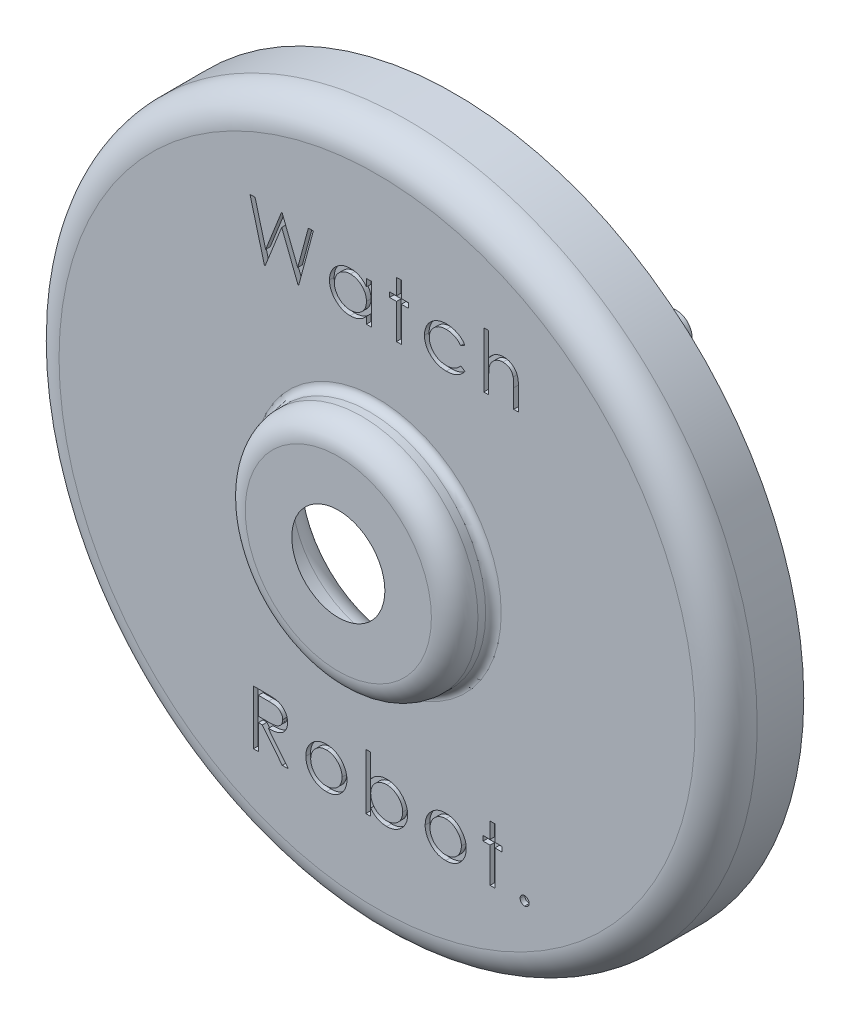
from build123d import *

# Parameters (mm, degrees)
ESQUISSE1_R             = 22.5
ESQUISSE1_R_2           = 20
BOSS_EXTRU_1_DEPTH      = 2.5
BOSS_EXTRU_2_START      = 0.5
ESQUISSE4_R             = 22.5
ESQUISSE4_R_2           = 20
BOSS_EXTRU_2_DEPTH      = 0.5
ENL_V_MAT_EXTRU_1_DEPTH = 0.3
ESQUISSE7_R             = 1
BOSS_EXTRU_3_DEPTH      = 7.3
ESQUISSE8_R             = 1.5
BOSS_EXTRU_4_DEPTH      = 1.7


with BuildPart() as part:
    # Esquisse1 → Boss.-Extru.1 (new body)
    with BuildSketch(Plane.XY):
        with Locations((0.293479975, -2.777879792)):
            Circle(ESQUISSE1_R)
        with Locations((0.293479975, -2.777879792)):
            Circle(ESQUISSE1_R_2, mode=Mode.SUBTRACT)
    extrude(amount=-BOSS_EXTRU_1_DEPTH)

    # Esquisse4 → Boss.-Extru.2 (add)
    with BuildSketch(Plane.XY.offset(BOSS_EXTRU_2_START)):
        with Locations((0.293479975, -2.777879792)):
            Circle(ESQUISSE4_R)
        with Locations((0.293479975, -2.777879792)):
            Circle(ESQUISSE4_R_2, mode=Mode.SUBTRACT)
    extrude(amount=-BOSS_EXTRU_2_DEPTH)

    # Esquisse5 → Révolution1 (revolve)
    with BuildSketch(Plane(origin=(0, -2.78, 0), x_dir=(-1, 0, 0), z_dir=(0, 1, 0))):
        with BuildLine():
            Line((-3.293479975, 5), (-6.293479975, 5))
            ThreePointArc((-6.293479975, 5), (-7.354140147, 4.560660172), (-7.793479975, 3.5))
            Line((-7.793479975, 3.5), (-7.793479975, 3))
            ThreePointArc((-7.793479975, 3), (-7.939926584, 2.646446609), (-8.293479975, 2.5))
            Line((-8.293479975, 2.5), (-20.793479975, 2.5))
            ThreePointArc((-20.793479975, 2.5), (-22.207693537, 1.914213562), (-22.793479975, 0.5))
            Line((-22.793479975, 0.5), (-20.293479975, 0.5))
            ThreePointArc((-20.293479975, 0.5), (-20.147033365, 0.853553391), (-19.793479975, 1))
            Line((-19.793479975, 1), (-7.293479975, 1))
            ThreePointArc((-7.293479975, 1), (-6.232819803, 1.439339828), (-5.793479975, 2.5))
            Line((-5.793479975, 2.5), (-5.793479975, 3.5))
            Line((-5.793479975, 3.5), (-3.293479975, 5))
        make_face()
    revolve(axis=Axis((0.293479975, -2.78, 19.488537607), (0, 0, -1)))

    # Esquisse6 → Enlèv. mat.-Extru.1 (cut)
    # profile 1 of 11: a face of its own
    with BuildSketch(Plane.XY.offset(2.5)):
        Polygon((-7.898717949, 12.5), (-7.574098558, 12.5), (-6.889102564, 9.933193109), (-5.870372596, 12.5), (-5.824799679, 12.5), (-4.825, 9.950721154), (-4.136498397, 12.5), (-3.815384615, 12.5), (-4.759094551, 9), (-4.803966346, 9), (-5.857051282, 11.676883013), (-6.92275641, 9), (-6.967628205, 9), align=None)
    # profile 2 of 11: a face of its own
    with BuildSketch(Plane.XY.offset(2.5)):
        with BuildLine():
            Line((-0.082051282, 11.557692308), (-0.082051282, 9))
            Line((-0.082051282, 9), (-0.396153846, 9))
            Line((-0.396153846, 9), (-0.396153846, 9.442407853))
            add(Edge.make_bspline(
                [(-0.396153846, 9.442407853), (-0.431572637, 9.402368259), (-0.500692852, 9.324230488), (-0.61613397, 9.222148315), (-0.738502148, 9.137769993), (-0.867203469, 9.069620078), (-1.002121712, 9.018428021), (-1.1429578, 8.982041862), (-1.289769181, 8.958648027), (-1.390021535, 8.956312005), (-1.440825321, 8.955128205)],
                knots=[0, 0, 0, 0, 1.074387032, 2.096679803, 3.090159297, 4.057316773, 5.018401886, 5.985159533, 6.978961417, 8, 8, 8, 8], degree=3))
            add(Edge.make_bspline(
                [(-1.440825321, 8.955128205), (-1.485993274, 8.956354577), (-1.575066479, 8.958773038), (-1.706095556, 8.977535341), (-1.832187806, 9.007665963), (-1.953462378, 9.049566853), (-2.069134524, 9.105147674), (-2.180194621, 9.171688922), (-2.286067313, 9.250929752), (-2.385138852, 9.341517781), (-2.476370852, 9.439912768), (-2.556432125, 9.544858315), (-2.623185204, 9.655900619), (-2.679005285, 9.771633773), (-2.72200163, 9.892948692), (-2.751975264, 10.01942586), (-2.770715711, 10.150915734), (-2.773133171, 10.240455257), (-2.774358974, 10.285857372)],
                knots=[0, 0, 0, 0, 1.033919861, 2.038935746, 3.024066025, 3.998881131, 4.97069526, 5.957263378, 6.95902576, 7.993208707, 9.027059324, 10.027763471, 11.009749337, 11.988697705, 12.965288445, 13.950418724, 14.960734635, 16, 16, 16, 16], degree=3))
            add(Edge.make_bspline(
                [(-2.774358974, 10.285857372), (-2.773106003, 10.330321075), (-2.770628946, 10.418223419), (-2.752175726, 10.547502117), (-2.721144718, 10.672020377), (-2.67759687, 10.791377321), (-2.621754915, 10.905717371), (-2.553826828, 11.015121396), (-2.473807703, 11.119890793), (-2.381555296, 11.21756202), (-2.281620526, 11.307782634), (-2.174711795, 11.38619168), (-2.063488514, 11.453908529), (-1.946225503, 11.507562005), (-1.824658399, 11.550971109), (-1.697704953, 11.581004078), (-1.565893374, 11.598701399), (-1.476402882, 11.601264163), (-1.431009615, 11.602564103)],
                knots=[0, 0, 0, 0, 1.020392517, 2.01726096, 2.990465484, 3.961182959, 4.928053699, 5.906110375, 6.912531644, 7.948652711, 8.985773172, 9.998621852, 10.987621588, 11.969261332, 12.953316658, 13.946091881, 14.958173133, 16, 16, 16, 16], degree=3))
            add(Edge.make_bspline(
                [(-1.431009615, 11.602564103), (-1.378809756, 11.601126351), (-1.276448296, 11.598306988), (-1.126720287, 11.574844261), (-0.985075809, 11.535205794), (-0.850421457, 11.481288296), (-0.723240771, 11.409639567), (-0.604737787, 11.319259606), (-0.493672303, 11.210718419), (-0.429292012, 11.127347974), (-0.396153846, 11.084435096)],
                knots=[0, 0, 0, 0, 1.038897134, 2.037228247, 3.008116434, 3.962042015, 4.918381754, 5.904844433, 6.921570401, 8, 8, 8, 8], degree=3))
            Line((-0.396153846, 11.084435096), (-0.396153846, 11.557692308))
            Line((-0.396153846, 11.557692308), (-0.082051282, 11.557692308))
        make_face()
        with BuildLine():
            add(Edge.make_bspline(
                [(-1.426802885, 11.288461538), (-1.472717222, 11.286827901), (-1.563344822, 11.28360336), (-1.696388825, 11.258429865), (-1.823702239, 11.21654527), (-1.944648313, 11.159263369), (-2.057316529, 11.087234632), (-2.1580102, 11.000113249), (-2.247552902, 10.900276235), (-2.322861166, 10.788174125), (-2.384251663, 10.667996033), (-2.427418695, 10.542371595), (-2.455887942, 10.413566618), (-2.458796463, 10.326203932), (-2.46025641, 10.282351763)],
                knots=[0, 0, 0, 0, 1.031046209, 2.035121221, 3.029706178, 4.034933723, 5.034054252, 6.02443088, 7.017295772, 8.038157696, 9.050218397, 10.03989886, 11.016116709, 12, 12, 12, 12], degree=3))
            add(Edge.make_bspline(
                [(-2.46025641, 10.282351763), (-2.458391517, 10.238761656), (-2.45466904, 10.1517523), (-2.427918346, 10.022771723), (-2.383038472, 9.897117681), (-2.32179641, 9.775856687), (-2.245109785, 9.663272587), (-2.156221132, 9.561532464), (-2.054270851, 9.474042876), (-1.941343344, 9.400805303), (-1.820735373, 9.341642782), (-1.693901442, 9.300477142), (-1.563225804, 9.273899362), (-1.47437347, 9.270794885), (-1.429607372, 9.269230769)],
                knots=[0, 0, 0, 0, 0.979072187, 1.954306742, 2.945804271, 3.96968567, 4.997920485, 5.998718438, 6.996577872, 8.005894225, 9.015743152, 10.005417472, 10.995077863, 12, 12, 12, 12], degree=3))
            add(Edge.make_bspline(
                [(-1.429607372, 9.269230769), (-1.384160869, 9.270890733), (-1.293772283, 9.274192237), (-1.160333575, 9.299473502), (-1.030838612, 9.3412423), (-0.907051383, 9.399141427), (-0.791735252, 9.470898783), (-0.688237375, 9.554905874), (-0.600721406, 9.652609058), (-0.526528797, 9.759985511), (-0.46835338, 9.877697508), (-0.425977321, 10.003031698), (-0.400923415, 10.135992447), (-0.397765685, 10.226856374), (-0.396153846, 10.273237179)],
                knots=[0, 0, 0, 0, 1.01762866, 2.023962475, 3.030623092, 4.058876274, 5.077231937, 6.066672613, 7.034107872, 8.005628644, 8.981990164, 9.965428785, 10.961468474, 12, 12, 12, 12], degree=3))
            add(Edge.make_bspline(
                [(-0.396153846, 10.273237179), (-0.397113503, 10.30857501), (-0.39900241, 10.378131043), (-0.413432979, 10.480258561), (-0.436387906, 10.577992287), (-0.468734076, 10.671434976), (-0.51122536, 10.760069991), (-0.562473126, 10.844533752), (-0.623378576, 10.924386963), (-0.692961272, 10.998530034), (-0.769126475, 11.066156496), (-0.849721015, 11.126520737), (-0.935699762, 11.17610951), (-1.025616799, 11.217150781), (-1.119628134, 11.249809931), (-1.218498753, 11.271597625), (-1.32117774, 11.286557946), (-1.391223796, 11.287820327), (-1.426802885, 11.288461538)],
                knots=[0, 0, 0, 0, 1.050140795, 2.067009409, 3.05949893, 4.030605086, 5.00011959, 5.97591094, 6.962425594, 7.979863591, 8.993523472, 9.986985069, 10.967611495, 11.937549037, 12.921786183, 13.919465291, 14.943216303, 16, 16, 16, 16], degree=3))
        make_face(mode=Mode.SUBTRACT)
    # profile 3 of 11: a face of its own
    with BuildSketch(Plane.XY.offset(2.5)):
        Polygon((1.542307692, 12.58974359), (1.856410256, 12.58974359), (1.856410256, 11.557692308), (2.305128205, 11.557692308), (2.305128205, 11.243589744), (1.856410256, 11.243589744), (1.856410256, 9), (1.542307692, 9), (1.542307692, 11.243589744), (1.093589744, 11.243589744), (1.093589744, 11.557692308), (1.542307692, 11.557692308), align=None)
    # profile 4 of 11: a face of its own
    with BuildSketch(Plane.XY.offset(2.5)):
        with BuildLine():
            Line((5.948717949, 11.003104968), (5.685797276, 10.83974359))
            add(Edge.make_bspline(
                [(5.685797276, 10.83974359), (5.65696741, 10.875571984), (5.600220715, 10.946094094), (5.501681479, 11.037104027), (5.396670064, 11.115271069), (5.283392017, 11.17897482), (5.162006217, 11.22819627), (5.032991365, 11.263026476), (4.896365861, 11.284730719), (4.802700661, 11.287197555), (4.754707532, 11.288461538)],
                knots=[0, 0, 0, 0, 1.026593902, 2.0206758, 2.988051866, 3.946915611, 4.916868779, 5.907761954, 6.927957743, 8, 8, 8, 8], degree=3))
            add(Edge.make_bspline(
                [(4.754707532, 11.288461538), (4.716348575, 11.287404696), (4.640801653, 11.285323274), (4.529895499, 11.272312781), (4.424253146, 11.248670773), (4.323212437, 11.217519816), (4.227492018, 11.175769526), (4.1368411, 11.12495977), (4.05045561, 11.06590973), (3.970838869, 10.997499184), (3.898009862, 10.923100516), (3.834910948, 10.843346821), (3.779974014, 10.76062693), (3.736868058, 10.672875188), (3.701592888, 10.582099134), (3.678386167, 10.486585279), (3.662921472, 10.387557271), (3.661152143, 10.320038931), (3.66025641, 10.285857372)],
                knots=[0, 0, 0, 0, 1.112346261, 2.190735716, 3.231507886, 4.247384806, 5.251966152, 6.253067467, 7.256802811, 8.280671706, 9.291813951, 10.270744147, 11.225547591, 12.165006084, 13.100104208, 14.043489273, 15.009504848, 16, 16, 16, 16], degree=3))
            add(Edge.make_bspline(
                [(3.66025641, 10.285857372), (3.662035662, 10.241088161), (3.665570193, 10.152152965), (3.693271653, 10.020874863), (3.73861606, 9.893951173), (3.800673911, 9.772283036), (3.879151045, 9.65968888), (3.971323608, 9.558705426), (4.077242692, 9.471289398), (4.195975022, 9.398816873), (4.324732766, 9.340555505), (4.462122871, 9.299048172), (4.607022651, 9.2739958), (4.706229398, 9.270839857), (4.756810897, 9.269230769)],
                knots=[0, 0, 0, 0, 0.966302908, 1.919585723, 2.883856336, 3.870342332, 4.860282998, 5.839159637, 6.814385684, 7.815993281, 8.834850808, 9.858348828, 10.908058873, 12, 12, 12, 12], degree=3))
            add(Edge.make_bspline(
                [(4.756810897, 9.269230769), (4.803166082, 9.270530266), (4.89426632, 9.273084123), (5.027433605, 9.294613087), (5.154213516, 9.32985672), (5.274601547, 9.37900437), (5.388377713, 9.442531886), (5.494806888, 9.520891057), (5.596006826, 9.611827657), (5.655503803, 9.682145629), (5.685797276, 9.717948718)],
                knots=[0, 0, 0, 0, 1.039848629, 2.043578496, 3.018386758, 3.987534228, 4.954977003, 5.934852016, 6.948509513, 8, 8, 8, 8], degree=3))
            Line((5.685797276, 9.717948718), (5.948717949, 9.545472756))
            add(Edge.make_bspline(
                [(5.948717949, 9.545472756), (5.933130247, 9.522582029), (5.90200658, 9.476876553), (5.849978954, 9.412432436), (5.793859122, 9.352110754), (5.733866026, 9.295992364), (5.670783016, 9.242734345), (5.602455106, 9.19488277), (5.531085495, 9.149747947), (5.455836337, 9.109135075), (5.377485639, 9.072628754), (5.296143649, 9.041237583), (5.212163837, 9.014267477), (5.12544746, 8.99283013), (5.035823562, 8.975719292), (4.943523928, 8.96436559), (4.848580346, 8.955890309), (4.784408195, 8.955384442), (4.751903045, 8.955128205)],
                knots=[0, 0, 0, 0, 0.954134338, 1.905101784, 2.851144739, 3.791306361, 4.734911809, 5.6936923, 6.663572882, 7.643865596, 8.638447847, 9.640600242, 10.646758161, 11.676244097, 12.717260333, 13.78922464, 14.880174919, 16, 16, 16, 16], degree=3))
            add(Edge.make_bspline(
                [(4.751903045, 8.955128205), (4.702292161, 8.956019485), (4.605054469, 8.9577664), (4.462731961, 8.976974875), (4.326718294, 9.005932491), (4.197059936, 9.047496225), (4.073736702, 9.101001001), (3.956863584, 9.166357915), (3.846827566, 9.244109705), (3.744716783, 9.332872475), (3.650935337, 9.429113115), (3.570409146, 9.532963033), (3.500563876, 9.640604081), (3.444476333, 9.754413607), (3.399829406, 9.87287898), (3.369324574, 9.99694922), (3.349594836, 10.125601474), (3.347311456, 10.213334356), (3.346153846, 10.2578125)],
                knots=[0, 0, 0, 0, 1.1129367, 2.181364009, 3.217532258, 4.231199276, 5.232079859, 6.230262199, 7.231623845, 8.250719726, 9.263571943, 10.242672461, 11.195837495, 12.138959767, 13.085126421, 14.0317438, 15.002148558, 16, 16, 16, 16], degree=3))
            add(Edge.make_bspline(
                [(3.346153846, 10.2578125), (3.346594862, 10.287990935), (3.347472116, 10.348020822), (3.357534044, 10.437115889), (3.370532517, 10.525024434), (3.392558254, 10.610632153), (3.417998886, 10.695237443), (3.450474417, 10.777820545), (3.488569812, 10.858765217), (3.53182176, 10.937862947), (3.580510505, 11.013812487), (3.634391738, 11.085566151), (3.691436074, 11.153985917), (3.754312186, 11.216709677), (3.82035184, 11.276245869), (3.891423416, 11.331003993), (3.967119267, 11.381144984), (4.04630259, 11.427595999), (4.128927301, 11.468955434), (4.214493972, 11.504588672), (4.302487001, 11.535041248), (4.393047145, 11.559150167), (4.485573318, 11.579367591), (4.580794656, 11.592085437), (4.678346878, 11.60107171), (4.744402901, 11.602062502), (4.777844551, 11.602564103)],
                knots=[0, 0, 0, 0, 0.990994727, 1.971252077, 2.943264845, 3.907940874, 4.872158414, 5.844625996, 6.82015047, 7.809835459, 8.804511986, 9.781214284, 10.756496977, 11.728388426, 12.696359165, 13.676225489, 14.672885716, 15.677705647, 16.690706858, 17.706033469, 18.721040654, 19.747369689, 20.783475414, 21.830280724, 22.901553713, 24, 24, 24, 24], degree=3))
            add(Edge.make_bspline(
                [(4.777844551, 11.602564103), (4.819724659, 11.601642212), (4.903275539, 11.599803037), (5.027216246, 11.584324385), (5.14933144, 11.560987969), (5.267478543, 11.526415139), (5.380225057, 11.484551483), (5.485760508, 11.437538769), (5.581600611, 11.382944165), (5.669528201, 11.323224051), (5.749707718, 11.255863145), (5.822962211, 11.180056188), (5.89079386, 11.096197709), (5.929250571, 11.034391978), (5.948717949, 11.003104968)],
                knots=[0, 0, 0, 0, 1.095225653, 2.184976855, 3.262915854, 4.344593502, 5.400796181, 6.407717688, 7.363229445, 8.282371371, 9.184954523, 10.097238608, 11.036792983, 12, 12, 12, 12], degree=3))
        make_face()
    # profile 5 of 11: a face of its own
    with BuildSketch(Plane.XY.offset(2.5)):
        with BuildLine():
            Line((7.169230769, 12.58974359), (7.483333333, 12.58974359))
            Line((7.483333333, 12.58974359), (7.483333333, 11.074619391))
            add(Edge.make_bspline(
                [(7.483333333, 11.074619391), (7.517050635, 11.116763373), (7.582699949, 11.198819866), (7.693196066, 11.305881057), (7.806666938, 11.398679678), (7.927031748, 11.472550135), (8.052082268, 11.530906678), (8.182345912, 11.572294325), (8.317846884, 11.597745421), (8.409872034, 11.600943839), (8.456490385, 11.602564103)],
                knots=[0, 0, 0, 0, 1.125788106, 2.19196713, 3.20547328, 4.180437432, 5.132270164, 6.079753143, 7.027236121, 8, 8, 8, 8], degree=3))
            add(Edge.make_bspline(
                [(8.456490385, 11.602564103), (8.503820777, 11.600818672), (8.596457773, 11.597402444), (8.731339236, 11.570389063), (8.857300111, 11.524231625), (8.973965953, 11.4610646), (9.07879065, 11.382391773), (9.171640415, 11.29156025), (9.247481213, 11.186286332), (9.29908033, 11.089030078), (9.332653738, 11.002491324), (9.353905565, 10.928254812), (9.371924763, 10.845532899), (9.387624499, 10.754368166), (9.39808808, 10.654322995), (9.406492698, 10.545848741), (9.412469153, 10.428951622), (9.412700757, 10.348031373), (9.412820513, 10.306189904)],
                knots=[0, 0, 0, 0, 1.235656852, 2.418478516, 3.575258207, 4.727955599, 5.870717718, 6.98870536, 8.107142894, 9.245821548, 9.854588956, 10.528768408, 11.260415777, 12.065282286, 12.943670737, 13.886611085, 14.907229059, 16, 16, 16, 16], degree=3))
            Line((9.412820513, 10.306189904), (9.412820513, 9))
            Line((9.412820513, 9), (9.098717949, 9))
            Line((9.098717949, 9), (9.098717949, 10.203125))
            add(Edge.make_bspline(
                [(9.098717949, 10.203125), (9.098527646, 10.23794767), (9.098163628, 10.30455751), (9.096960283, 10.399923618), (9.094274068, 10.486419753), (9.089933242, 10.563768705), (9.085367935, 10.632078308), (9.079084618, 10.691249362), (9.071774384, 10.741363138), (9.065205602, 10.771527766), (9.062259615, 10.78505609)],
                knots=[0, 0, 0, 0, 1.430932559, 2.737130458, 3.918967929, 4.986496826, 5.920444988, 6.731744033, 7.431208747, 8, 8, 8, 8], degree=3))
            add(Edge.make_bspline(
                [(9.062259615, 10.78505609), (9.05083537, 10.824750353), (9.028872326, 10.901062344), (8.977824348, 11.004724754), (8.914065337, 11.093109495), (8.836218076, 11.165023783), (8.745659712, 11.221435322), (8.641799748, 11.260503105), (8.525615679, 11.284750827), (8.443764207, 11.28719013), (8.401101763, 11.288461538)],
                knots=[0, 0, 0, 0, 1.090059168, 2.095632401, 3.037101401, 3.955032261, 4.878929692, 5.839099886, 6.873700383, 8, 8, 8, 8], degree=3))
            add(Edge.make_bspline(
                [(8.401101763, 11.288461538), (8.37583399, 11.287985712), (8.325829719, 11.287044064), (8.251681054, 11.277590166), (8.17975199, 11.262141447), (8.109349812, 11.241236908), (8.041966614, 11.212791372), (7.97563829, 11.179861183), (7.912244081, 11.139552928), (7.850658264, 11.09432716), (7.79334073, 11.0442574), (7.740013615, 10.991410445), (7.692475275, 10.935135481), (7.649406684, 10.876335365), (7.612228398, 10.814203572), (7.579775316, 10.749339253), (7.55223962, 10.681657108), (7.538556927, 10.634682046), (7.531710737, 10.611177885)],
                knots=[0, 0, 0, 0, 1.024319606, 2.027102035, 3.025350316, 4.005802111, 5.00026367, 5.987881639, 7.005602596, 8.042517216, 9.083927026, 10.089214625, 11.084353441, 12.06828073, 13.041928858, 14.016821737, 15.00770877, 16, 16, 16, 16], degree=3))
            add(Edge.make_bspline(
                [(7.531710737, 10.611177885), (7.52777131, 10.594156934), (7.519186813, 10.557066187), (7.50987198, 10.495891863), (7.501534183, 10.424805491), (7.494485633, 10.34391489), (7.490162547, 10.252923648), (7.485504306, 10.152452689), (7.483770292, 10.041872668), (7.483483339, 9.964977161), (7.483333333, 9.924779647)],
                knots=[0, 0, 0, 0, 0.607992626, 1.324890765, 2.152360218, 3.099583803, 4.150613268, 5.323148443, 6.60066238, 8, 8, 8, 8], degree=3))
            Line((7.483333333, 9.924779647), (7.483333333, 9))
            Line((7.483333333, 9), (7.169230769, 9))
            Line((7.169230769, 9), (7.169230769, 12.58974359))
        make_face()
    # profile 6 of 11: a face of its own
    with BuildSketch(Plane.XY.offset(2.5)):
        with BuildLine():
            Line((-7.674358974, -14.833333333), (-6.973938301, -14.833333333))
            add(Edge.make_bspline(
                [(-6.973938301, -14.833333333), (-6.927197173, -14.833488919), (-6.837449028, -14.833787662), (-6.708875758, -14.835453425), (-6.592048661, -14.84022778), (-6.487028822, -14.844336364), (-6.393818167, -14.851828305), (-6.312130876, -14.858988952), (-6.242343178, -14.868362613), (-6.200097327, -14.877068036), (-6.180969551, -14.881009615)],
                knots=[0, 0, 0, 0, 1.410062039, 2.707475311, 3.878576406, 4.937260626, 5.877586885, 6.699081471, 7.410979367, 8, 8, 8, 8], degree=3))
            add(Edge.make_bspline(
                [(-6.180969551, -14.881009615), (-6.155362927, -14.887336381), (-6.104695938, -14.899854944), (-6.031745872, -14.926314545), (-5.962231548, -14.95693417), (-5.896441723, -14.99289789), (-5.834705932, -15.03447267), (-5.776387621, -15.080940792), (-5.721222158, -15.132047998), (-5.671440528, -15.18908284), (-5.624501476, -15.248919349), (-5.58491285, -15.313623106), (-5.55078637, -15.381284634), (-5.523615853, -15.452592051), (-5.501737879, -15.526853823), (-5.48631164, -15.60474262), (-5.477060452, -15.685903595), (-5.476118597, -15.741261504), (-5.475641026, -15.769330929)],
                knots=[0, 0, 0, 0, 1.027469482, 2.033020251, 3.019912614, 3.986113645, 4.951240523, 5.91722682, 6.890402269, 7.87763091, 8.8651537, 9.85103654, 10.82876324, 11.815024772, 12.821070561, 13.842952187, 14.906261191, 16, 16, 16, 16], degree=3))
            add(Edge.make_bspline(
                [(-5.475641026, -15.769330929), (-5.477110024, -15.815966034), (-5.47997642, -15.906963202), (-5.506701523, -16.039024083), (-5.550478043, -16.162213398), (-5.610801332, -16.276376036), (-5.687620808, -16.379286681), (-5.779945599, -16.469677137), (-5.88782721, -16.545317049), (-5.988256526, -16.597769854), (-6.076970726, -16.631362763), (-6.150004039, -16.654999121), (-6.229671016, -16.673261087), (-6.315208351, -16.689621218), (-6.406972006, -16.701972913), (-6.504742046, -16.711019507), (-6.608588197, -16.716673556), (-6.679927267, -16.717515561), (-6.716626603, -16.717948718)],
                knots=[0, 0, 0, 0, 1.260483769, 2.459530307, 3.627416485, 4.787058657, 5.939039949, 7.08810263, 8.267026773, 9.491475466, 10.141966685, 10.831826277, 11.566392101, 12.351337768, 13.187381173, 14.07005841, 15.007169909, 16, 16, 16, 16], degree=3))
            Line((-6.716626603, -16.717948718), (-5.430769231, -18.333333333))
            Line((-5.430769231, -18.333333333), (-5.819190705, -18.333333333))
            Line((-5.819190705, -18.333333333), (-7.105048077, -16.717948718))
            Line((-7.105048077, -16.717948718), (-7.36025641, -16.717948718))
            Line((-7.36025641, -16.717948718), (-7.36025641, -18.333333333))
            Line((-7.36025641, -18.333333333), (-7.674358974, -18.333333333))
            Line((-7.674358974, -18.333333333), (-7.674358974, -14.833333333))
        make_face()
        with BuildLine():
            Line((-7.36025641, -15.192307692), (-7.36025641, -16.358974359))
            Line((-7.36025641, -16.358974359), (-6.71943109, -16.363882212))
            add(Edge.make_bspline(
                [(-6.71943109, -16.363882212), (-6.689511051, -16.363895448), (-6.631517494, -16.363921105), (-6.547616829, -16.359927328), (-6.469496717, -16.35538401), (-6.397455965, -16.348434665), (-6.33146239, -16.339478593), (-6.271548976, -16.328275609), (-6.217617925, -16.315223546), (-6.154719386, -16.29502192), (-6.084482855, -16.263015902), (-6.008151395, -16.216450403), (-5.943149057, -16.157881284), (-5.888231195, -16.090907828), (-5.844101763, -16.017271579), (-5.812989709, -15.93785521), (-5.793247267, -15.854663612), (-5.790918721, -15.797485504), (-5.78974359, -15.768629808)],
                knots=[0, 0, 0, 0, 1.146690395, 2.22261258, 3.21895312, 4.145990853, 4.996080663, 5.770904154, 6.481378293, 7.121626537, 8.300444488, 9.431385265, 10.535395872, 11.636531494, 12.74115979, 13.810798291, 14.895190096, 16, 16, 16, 16], degree=3))
            add(Edge.make_bspline(
                [(-5.78974359, -15.768629808), (-5.790945711, -15.740483234), (-5.793327876, -15.684706995), (-5.812776645, -15.603051085), (-5.845666026, -15.525984135), (-5.889988264, -15.45381965), (-5.943987419, -15.388313914), (-6.007305232, -15.332266761), (-6.078210427, -15.286017296), (-6.144481625, -15.256462916), (-6.203715838, -15.238343063), (-6.255145498, -15.225591899), (-6.313256975, -15.21534743), (-6.378332434, -15.207139369), (-6.450094065, -15.200084425), (-6.528904716, -15.195332646), (-6.614241496, -15.192518782), (-6.673388427, -15.192379693), (-6.70400641, -15.192307692)],
                knots=[0, 0, 0, 0, 1.101028733, 2.181837193, 3.264309656, 4.369019818, 5.486613113, 6.575447106, 7.666700264, 8.788928104, 9.402425223, 10.0903467, 10.862060571, 11.710948788, 12.657782767, 13.684531032, 14.801375019, 16, 16, 16, 16], degree=3))
            Line((-6.70400641, -15.192307692), (-7.36025641, -15.192307692))
        make_face(mode=Mode.SUBTRACT)
    # profile 7 of 11: a face of its own
    with BuildSketch(Plane.XY.offset(2.5)):
        with BuildLine():
            add(Edge.make_bspline(
                [(-2.974879808, -15.730769231), (-2.926888535, -15.731791122), (-2.832789377, -15.733794801), (-2.694981491, -15.755209766), (-2.563436355, -15.787957131), (-2.437650163, -15.833228693), (-2.319233868, -15.893910643), (-2.206462624, -15.966319934), (-2.099645615, -16.052102528), (-2.035622586, -16.118460596), (-2.003125, -16.152143429)],
                knots=[0, 0, 0, 0, 1.054011418, 2.066658804, 3.057071809, 4.030435133, 4.997543892, 5.974964718, 6.972108034, 8, 8, 8, 8], degree=3))
            add(Edge.make_bspline(
                [(-2.003125, -16.152143429), (-1.975143046, -16.184357415), (-1.919720666, -16.248161957), (-1.848654947, -16.35161757), (-1.787433387, -16.458757671), (-1.738370426, -16.571004998), (-1.699685402, -16.687379669), (-1.672219706, -16.80828168), (-1.655882771, -16.933444027), (-1.653679804, -17.018447865), (-1.652564103, -17.061498397)],
                knots=[0, 0, 0, 0, 1.025258237, 2.030674902, 3.01204498, 3.988269485, 4.97094183, 5.956517959, 6.965070386, 8, 8, 8, 8], degree=3))
            add(Edge.make_bspline(
                [(-1.652564103, -17.061498397), (-1.65354544, -17.104798455), (-1.655484608, -17.190361388), (-1.673828225, -17.316380754), (-1.70235931, -17.438575577), (-1.743191149, -17.556434271), (-1.795549258, -17.670317098), (-1.859439945, -17.779726647), (-1.935311563, -17.884878781), (-2.021315559, -17.984880619), (-2.116367435, -18.077046834), (-2.219483584, -18.157375103), (-2.328637618, -18.226196628), (-2.445280971, -18.281633043), (-2.568348458, -18.325342744), (-2.698105526, -18.35604276), (-2.834350596, -18.374604444), (-2.927377817, -18.376988017), (-2.974879808, -18.378205128)],
                knots=[0, 0, 0, 0, 0.998656419, 1.973391657, 2.932242238, 3.890759089, 4.846373663, 5.82037756, 6.809684879, 7.83454468, 8.860553229, 9.859544525, 10.845671541, 11.83227036, 12.833544569, 13.85385346, 14.904124723, 16, 16, 16, 16], degree=3))
            add(Edge.make_bspline(
                [(-2.974879808, -18.378205128), (-3.022614527, -18.376983932), (-3.116105387, -18.374592158), (-3.252831369, -18.356114875), (-3.382820988, -18.325356892), (-3.506049586, -18.281489399), (-3.623194433, -18.226194856), (-3.73298093, -18.157583166), (-3.836180846, -18.077023011), (-3.93125283, -17.984887074), (-4.017251435, -17.884877118), (-4.093124444, -17.779727079), (-4.15701477, -17.670316986), (-4.209372974, -17.556434301), (-4.250204787, -17.438575569), (-4.278735879, -17.316380756), (-4.297079494, -17.190361388), (-4.299018663, -17.104798455), (-4.3, -17.061498397)],
                knots=[0, 0, 0, 0, 1.099876186, 2.154163076, 3.173186993, 4.173200201, 5.163417411, 6.152872554, 7.150605724, 8.17532212, 9.198891216, 10.186952605, 11.159729845, 12.11414092, 13.071450619, 14.029093627, 15.002601286, 16, 16, 16, 16], degree=3))
            add(Edge.make_bspline(
                [(-4.3, -17.061498397), (-4.29887669, -17.018681852), (-4.296652728, -16.933912449), (-4.280332219, -16.808985388), (-4.252973663, -16.688287999), (-4.214242266, -16.572362523), (-4.164727075, -16.460607087), (-4.104365787, -16.353202256), (-4.032575155, -16.250214456), (-3.977373203, -16.186492376), (-3.949439103, -16.154246795)],
                knots=[0, 0, 0, 0, 1.031353054, 2.041901799, 3.029428768, 4.008703097, 4.981709435, 5.96992636, 6.972712378, 8, 8, 8, 8], degree=3))
            add(Edge.make_bspline(
                [(-3.949439103, -16.154246795), (-3.916990512, -16.120271856), (-3.853174648, -16.053454159), (-3.74582592, -15.967921635), (-3.633332099, -15.894005561), (-3.513607173, -15.834529346), (-3.387924315, -15.787690828), (-3.255705072, -15.755125313), (-3.117429557, -15.733871958), (-3.022869936, -15.73181378), (-2.974879808, -15.730769231)],
                knots=[0, 0, 0, 0, 1.027980169, 2.021703884, 2.998553061, 3.971491411, 4.943284454, 5.930300938, 6.949603206, 8, 8, 8, 8], degree=3))
        make_face()
        with BuildLine():
            add(Edge.make_bspline(
                [(-2.976282051, -16.044871795), (-3.010219663, -16.045836387), (-3.077218791, -16.047740669), (-3.175838376, -16.062224574), (-3.27077853, -16.085172078), (-3.362219374, -16.117776134), (-3.449852546, -16.159875033), (-3.533761949, -16.211583393), (-3.614194389, -16.27221635), (-3.689576452, -16.341679021), (-3.758758764, -16.417558016), (-3.819236741, -16.498406375), (-3.870661847, -16.582912721), (-3.913502006, -16.671164932), (-3.945409194, -16.764057346), (-3.968582217, -16.860537977), (-3.983052457, -16.960803394), (-3.984938836, -17.028964412), (-3.985897436, -17.063601763)],
                knots=[0, 0, 0, 0, 1.021534396, 2.016698045, 2.994645724, 3.958388632, 4.93408049, 5.916473867, 6.921342795, 7.962252576, 8.998418191, 10.008913653, 10.997312074, 11.973003931, 12.956656626, 13.948281152, 14.957379055, 16, 16, 16, 16], degree=3))
            add(Edge.make_bspline(
                [(-3.985897436, -17.063601763), (-3.984290612, -17.10835379), (-3.981101368, -17.197178195), (-3.955166131, -17.327989318), (-3.911779851, -17.45357117), (-3.853192572, -17.573187556), (-3.779786353, -17.683859834), (-3.693299286, -17.782531319), (-3.594659586, -17.86771713), (-3.485043086, -17.938397976), (-3.366688768, -17.994557731), (-3.241432447, -18.034356707), (-3.110791753, -18.0602284), (-3.021511022, -18.062799874), (-2.976282051, -18.064102564)],
                knots=[0, 0, 0, 0, 1.016792936, 2.018143844, 3.017858371, 4.030088057, 5.03801393, 6.028138512, 7.003788237, 7.991172063, 8.984598303, 9.972568034, 10.972917682, 12, 12, 12, 12], degree=3))
            add(Edge.make_bspline(
                [(-2.976282051, -18.064102564), (-2.931055682, -18.062792284), (-2.841780086, -18.060205827), (-2.71132091, -18.034487007), (-2.586406938, -17.994383347), (-2.46817555, -17.938461137), (-2.358608947, -17.867448722), (-2.259259825, -17.783012345), (-2.173511214, -17.683598493), (-2.100177609, -17.573040965), (-2.040630867, -17.453756613), (-1.997447665, -17.32796614), (-1.971450079, -17.197184098), (-1.96826925, -17.108355768), (-1.966666667, -17.063601763)],
                knots=[0, 0, 0, 0, 1.02726834, 2.027799167, 3.010890988, 4.004497153, 4.992059811, 5.971914811, 6.958719428, 7.966827853, 8.981595046, 9.981490638, 10.983022906, 12, 12, 12, 12], degree=3))
            add(Edge.make_bspline(
                [(-1.966666667, -17.063601763), (-1.967624937, -17.028964205), (-1.969510666, -16.960802779), (-1.98398563, -16.860540326), (-2.00714117, -16.764048729), (-2.039112787, -16.671196726), (-2.081766801, -16.582684222), (-2.134183594, -16.498654495), (-2.194414619, -16.417277949), (-2.26443174, -16.341924308), (-2.339735118, -16.272189271), (-2.420200156, -16.211559882), (-2.503985135, -16.160102286), (-2.591363718, -16.117416046), (-2.682816285, -16.085468705), (-2.777623414, -16.062092074), (-2.875822224, -16.047801877), (-2.942581268, -16.045854736), (-2.976282051, -16.044871795)],
                knots=[0, 0, 0, 0, 1.042956736, 2.052379634, 3.044323526, 4.02829302, 5.004299113, 5.996692471, 7.007513377, 8.048758398, 9.090003419, 10.095195979, 11.07790575, 12.047570684, 13.018257071, 13.989683339, 14.985167495, 16, 16, 16, 16], degree=3))
        make_face(mode=Mode.SUBTRACT)
    # profile 8 of 11: a face of its own
    with BuildSketch(Plane.XY.offset(2.5)):
        with BuildLine():
            Line((-0.432051282, -18.333333333), (-0.432051282, -14.743589744))
            Line((-0.432051282, -14.743589744), (-0.117948718, -14.743589744))
            Line((-0.117948718, -14.743589744), (-0.117948718, -16.239783654))
            add(Edge.make_bspline(
                [(-0.117948718, -16.239783654), (-0.082555299, -16.199025722), (-0.01350128, -16.119505317), (0.102275172, -16.015657667), (0.223680741, -15.92760519), (0.351638997, -15.855019071), (0.48633193, -15.799745464), (0.627064039, -15.759323074), (0.77419508, -15.734936171), (0.874514254, -15.732170098), (0.925320513, -15.730769231)],
                knots=[0, 0, 0, 0, 1.077089805, 2.101446609, 3.097517232, 4.067117542, 5.031729543, 5.997785507, 6.985986182, 8, 8, 8, 8], degree=3))
            add(Edge.make_bspline(
                [(0.925320513, -15.730769231), (0.970486651, -15.732009459), (1.059787803, -15.734461601), (1.19106995, -15.753096097), (1.317383225, -15.783313899), (1.438658873, -15.825206078), (1.554331005, -15.880789055), (1.665390062, -15.947330363), (1.771267047, -16.026568692), (1.870321932, -16.117167003), (1.961615818, -16.215523626), (2.041528329, -16.320703941), (2.109028025, -16.431179031), (2.164859317, -16.546579094), (2.20803037, -16.667375445), (2.237772638, -16.793449644), (2.256666102, -16.924677662), (2.259046348, -17.013990466), (2.26025641, -17.059395032)],
                knots=[0, 0, 0, 0, 1.034377878, 2.045141349, 3.03070803, 4.00595497, 4.978199603, 5.965204761, 6.967410914, 8.002051993, 9.036360596, 10.037508045, 11.022711142, 11.997267194, 12.969246472, 13.954813154, 14.960274251, 16, 16, 16, 16], degree=3))
            add(Edge.make_bspline(
                [(2.26025641, -17.059395032), (2.25901997, -17.10409505), (2.256581904, -17.192236445), (2.237960596, -17.321943001), (2.207214331, -17.4467817), (2.163253148, -17.566429958), (2.107988209, -17.681449871), (2.038876933, -17.790530275), (1.959065934, -17.895569251), (1.866734785, -17.993192882), (1.766821232, -18.083426282), (1.65990699, -18.161832148), (1.548685068, -18.229549268), (1.431421956, -18.283204715), (1.309853914, -18.326605637), (1.182678527, -18.356723327), (1.050615299, -18.374296382), (0.960896411, -18.376891949), (0.915504808, -18.378205128)],
                knots=[0, 0, 0, 0, 1.024244038, 2.01964794, 2.996620209, 3.965911562, 4.936179293, 5.91563013, 6.920572822, 7.955171681, 8.990768464, 10.002129126, 10.989675881, 11.969873457, 12.952483066, 13.943799762, 14.959703725, 16, 16, 16, 16], degree=3))
            add(Edge.make_bspline(
                [(0.915504808, -18.378205128), (0.863539695, -18.37676452), (0.761645171, -18.373939738), (0.612592506, -18.350520759), (0.471510956, -18.310659149), (0.336793408, -18.257097393), (0.210365685, -18.184568739), (0.091425103, -18.094611989), (-0.01927827, -17.985744852), (-0.084495085, -17.902683363), (-0.117948718, -17.860076122)],
                knots=[0, 0, 0, 0, 1.035807596, 2.031038093, 2.998900396, 3.954262848, 4.914341711, 5.895762244, 6.92060972, 8, 8, 8, 8], degree=3))
            Line((-0.117948718, -17.860076122), (-0.117948718, -18.333333333))
            Line((-0.117948718, -18.333333333), (-0.432051282, -18.333333333))
        make_face()
        with BuildLine():
            add(Edge.make_bspline(
                [(0.912700321, -18.064102564), (0.958614673, -18.062468935), (1.049242302, -18.059244412), (1.182286092, -18.034070789), (1.309600302, -17.992186675), (1.430543384, -17.934902966), (1.543222696, -17.862880932), (1.64387533, -17.775734761), (1.73335504, -17.676233246), (1.808006816, -17.563999553), (1.87033306, -17.444548584), (1.913146336, -17.318894283), (1.941866058, -17.190399493), (1.944718356, -17.103253449), (1.946153846, -17.059395032)],
                knots=[0, 0, 0, 0, 1.031910345, 2.036826888, 3.032245421, 4.038315463, 5.03827337, 6.029480047, 7.023177075, 8.037597977, 9.052889626, 10.043399556, 11.015292101, 12, 12, 12, 12], degree=3))
            add(Edge.make_bspline(
                [(1.946153846, -17.059395032), (1.944266102, -17.01557949), (1.940498151, -16.928123329), (1.914123368, -16.798473662), (1.868065578, -16.672886037), (1.806947555, -16.551708049), (1.73107957, -16.438700248), (1.642073606, -16.337210121), (1.5401918, -16.249650137), (1.427368381, -16.176660066), (1.30718819, -16.117100513), (1.180697556, -16.076255487), (1.050539434, -16.0495173), (0.962143941, -16.046428172), (0.917608173, -16.044871795)],
                knots=[0, 0, 0, 0, 0.984795267, 1.965658976, 2.959410029, 3.983795688, 5.009594896, 6.01088574, 7.009236619, 8.019050059, 9.024672985, 10.014834719, 10.999826153, 12, 12, 12, 12], degree=3))
            add(Edge.make_bspline(
                [(0.917608173, -16.044871795), (0.872140666, -16.046427292), (0.781896889, -16.049514639), (0.648728667, -16.076302463), (0.518665383, -16.117350075), (0.394377851, -16.176281424), (0.278523796, -16.248392884), (0.174911184, -16.333133084), (0.085579626, -16.429912992), (0.012035855, -16.538418794), (-0.046368944, -16.655603829), (-0.088152692, -16.780616033), (-0.113152338, -16.912797345), (-0.116330471, -17.003430551), (-0.117948718, -17.049579327)],
                knots=[0, 0, 0, 0, 1.016820015, 2.018181405, 3.029022337, 4.06341356, 5.088169224, 6.076823655, 7.05054209, 8.02560866, 9.001194327, 9.972267242, 10.967515442, 12, 12, 12, 12], degree=3))
            add(Edge.make_bspline(
                [(-0.117948718, -17.049579327), (-0.116989048, -17.084917145), (-0.115100112, -17.154473155), (-0.100669744, -17.256600846), (-0.077714082, -17.354333938), (-0.045370588, -17.447778933), (-0.002869353, -17.536405373), (0.048340912, -17.620901453), (0.109292559, -17.700504731), (0.178199148, -17.775020052), (0.254161529, -17.842829466), (0.335684648, -17.901607691), (0.421102578, -17.952221881), (0.511392549, -17.992566724), (0.60550384, -18.025493244), (0.704402181, -18.04722699), (0.807073605, -18.062202029), (0.877120702, -18.063462382), (0.912700321, -18.064102564)],
                knots=[0, 0, 0, 0, 1.050331198, 2.067384183, 3.060053655, 4.031335885, 5.001026174, 5.976994447, 6.963687968, 7.976578778, 8.990422448, 9.985569286, 10.960374351, 11.936812464, 12.921228065, 13.919088064, 14.943024695, 16, 16, 16, 16], degree=3))
        make_face(mode=Mode.SUBTRACT)
    # profile 9 of 11: a face of its own
    with BuildSketch(Plane.XY.offset(2.5)):
        with BuildLine():
            add(Edge.make_bspline(
                [(4.716145833, -15.730769231), (4.764137106, -15.731791122), (4.858236264, -15.733794801), (4.99604415, -15.755209766), (5.127589286, -15.787957131), (5.253375478, -15.833228693), (5.371791773, -15.893910643), (5.484563017, -15.966319934), (5.591380026, -16.052102528), (5.655403055, -16.118460596), (5.687900641, -16.152143429)],
                knots=[0, 0, 0, 0, 1.054011418, 2.066658804, 3.057071809, 4.030435133, 4.997543892, 5.974964718, 6.972108034, 8, 8, 8, 8], degree=3))
            add(Edge.make_bspline(
                [(5.687900641, -16.152143429), (5.715882595, -16.184357415), (5.771304975, -16.248161957), (5.842370694, -16.35161757), (5.903592254, -16.458757671), (5.952655215, -16.571004998), (5.991340239, -16.687379669), (6.018805935, -16.80828168), (6.03514287, -16.933444027), (6.037345837, -17.018447865), (6.038461538, -17.061498397)],
                knots=[0, 0, 0, 0, 1.025258237, 2.030674902, 3.01204498, 3.988269485, 4.97094183, 5.956517959, 6.965070386, 8, 8, 8, 8], degree=3))
            add(Edge.make_bspline(
                [(6.038461538, -17.061498397), (6.037480201, -17.104798455), (6.035541033, -17.190361388), (6.017197416, -17.316380754), (5.988666331, -17.438575577), (5.947834492, -17.556434271), (5.895476383, -17.670317098), (5.831585696, -17.779726647), (5.755714078, -17.884878781), (5.669710082, -17.984880619), (5.574658206, -18.077046834), (5.471542057, -18.157375103), (5.362388023, -18.226196628), (5.24574467, -18.281633043), (5.122677183, -18.325342744), (4.992920115, -18.35604276), (4.856675045, -18.374604444), (4.763647824, -18.376988017), (4.716145833, -18.378205128)],
                knots=[0, 0, 0, 0, 0.998656419, 1.973391657, 2.932242238, 3.890759089, 4.846373663, 5.82037756, 6.809684879, 7.83454468, 8.860553229, 9.859544525, 10.845671541, 11.83227036, 12.833544569, 13.85385346, 14.904124723, 16, 16, 16, 16], degree=3))
            add(Edge.make_bspline(
                [(4.716145833, -18.378205128), (4.668411114, -18.376983932), (4.574920254, -18.374592158), (4.438194272, -18.356114875), (4.308204653, -18.325356892), (4.184976055, -18.281489399), (4.067831208, -18.226194856), (3.958044711, -18.157583166), (3.854844795, -18.077023011), (3.759772811, -17.984887074), (3.673774206, -17.884877118), (3.597901197, -17.779727079), (3.534010871, -17.670316986), (3.481652667, -17.556434301), (3.440820854, -17.438575569), (3.412289762, -17.316380756), (3.393946147, -17.190361388), (3.392006978, -17.104798455), (3.391025641, -17.061498397)],
                knots=[0, 0, 0, 0, 1.099876186, 2.154163076, 3.173186993, 4.173200201, 5.163417411, 6.152872554, 7.150605724, 8.17532212, 9.198891216, 10.186952605, 11.159729845, 12.11414092, 13.071450619, 14.029093627, 15.002601286, 16, 16, 16, 16], degree=3))
            add(Edge.make_bspline(
                [(3.391025641, -17.061498397), (3.392148951, -17.018681852), (3.394372913, -16.933912449), (3.410693422, -16.808985388), (3.438051978, -16.688287999), (3.476783375, -16.572362523), (3.526298566, -16.460607087), (3.586659854, -16.353202256), (3.658450486, -16.250214456), (3.713652438, -16.186492376), (3.741586538, -16.154246795)],
                knots=[0, 0, 0, 0, 1.031353054, 2.041901799, 3.029428768, 4.008703097, 4.981709435, 5.96992636, 6.972712378, 8, 8, 8, 8], degree=3))
            add(Edge.make_bspline(
                [(3.741586538, -16.154246795), (3.774035129, -16.120271856), (3.837850993, -16.053454159), (3.945199721, -15.967921635), (4.057693542, -15.894005561), (4.177418468, -15.834529346), (4.303101326, -15.787690828), (4.435320569, -15.755125313), (4.573596084, -15.733871958), (4.668155705, -15.73181378), (4.716145833, -15.730769231)],
                knots=[0, 0, 0, 0, 1.027980169, 2.021703884, 2.998553061, 3.971491411, 4.943284454, 5.930300938, 6.949603206, 8, 8, 8, 8], degree=3))
        make_face()
        with BuildLine():
            add(Edge.make_bspline(
                [(4.71474359, -16.044871795), (4.680805978, -16.045836387), (4.61380685, -16.047740669), (4.515187265, -16.062224574), (4.420247111, -16.085172078), (4.328806267, -16.117776134), (4.241173095, -16.159875033), (4.157263692, -16.211583393), (4.076831252, -16.27221635), (4.001449189, -16.341679021), (3.932266877, -16.417558016), (3.8717889, -16.498406375), (3.820363794, -16.582912721), (3.777523635, -16.671164932), (3.745616447, -16.764057346), (3.722443424, -16.860537977), (3.707973184, -16.960803394), (3.706086805, -17.028964412), (3.705128205, -17.063601763)],
                knots=[0, 0, 0, 0, 1.021534396, 2.016698045, 2.994645724, 3.958388632, 4.93408049, 5.916473867, 6.921342795, 7.962252576, 8.998418191, 10.008913653, 10.997312074, 11.973003931, 12.956656626, 13.948281152, 14.957379055, 16, 16, 16, 16], degree=3))
            add(Edge.make_bspline(
                [(3.705128205, -17.063601763), (3.706735029, -17.10835379), (3.709924273, -17.197178195), (3.73585951, -17.327989318), (3.77924579, -17.45357117), (3.837833069, -17.573187556), (3.911239288, -17.683859834), (3.997726355, -17.782531319), (4.096366055, -17.86771713), (4.205982555, -17.938397976), (4.324336873, -17.994557731), (4.449593194, -18.034356707), (4.580233888, -18.0602284), (4.669514619, -18.062799874), (4.71474359, -18.064102564)],
                knots=[0, 0, 0, 0, 1.016792936, 2.018143844, 3.017858371, 4.030088057, 5.03801393, 6.028138512, 7.003788237, 7.991172063, 8.984598303, 9.972568034, 10.972917682, 12, 12, 12, 12], degree=3))
            add(Edge.make_bspline(
                [(4.71474359, -18.064102564), (4.759969959, -18.062792284), (4.849245555, -18.060205827), (4.979704731, -18.034487007), (5.104618703, -17.994383347), (5.222850091, -17.938461137), (5.332416694, -17.867448722), (5.431765816, -17.783012345), (5.517514427, -17.683598493), (5.590848032, -17.573040965), (5.650394774, -17.453756613), (5.693577976, -17.32796614), (5.719575562, -17.197184098), (5.722756391, -17.108355768), (5.724358974, -17.063601763)],
                knots=[0, 0, 0, 0, 1.02726834, 2.027799167, 3.010890988, 4.004497153, 4.992059811, 5.971914811, 6.958719428, 7.966827853, 8.981595046, 9.981490638, 10.983022906, 12, 12, 12, 12], degree=3))
            add(Edge.make_bspline(
                [(5.724358974, -17.063601763), (5.723400704, -17.028964205), (5.721514975, -16.960802779), (5.707040011, -16.860540326), (5.683884471, -16.764048729), (5.651912854, -16.671196726), (5.60925884, -16.582684222), (5.556842047, -16.498654495), (5.496611022, -16.417277949), (5.426593901, -16.341924308), (5.351290523, -16.272189271), (5.270825485, -16.211559882), (5.187040506, -16.160102286), (5.099661923, -16.117416046), (5.008209356, -16.085468705), (4.913402227, -16.062092074), (4.815203417, -16.047801877), (4.748444373, -16.045854736), (4.71474359, -16.044871795)],
                knots=[0, 0, 0, 0, 1.042956736, 2.052379634, 3.044323526, 4.02829302, 5.004299113, 5.996692471, 7.007513377, 8.048758398, 9.090003419, 10.095195979, 11.07790575, 12.047570684, 13.018257071, 13.989683339, 14.985167495, 16, 16, 16, 16], degree=3))
        make_face(mode=Mode.SUBTRACT)
    # profile 10 of 11: a face of its own
    with BuildSketch(Plane.XY.offset(2.5)):
        Polygon((7.573076923, -14.743589744), (7.887179487, -14.743589744), (7.887179487, -15.775641026), (8.335897436, -15.775641026), (8.335897436, -16.08974359), (7.887179487, -16.08974359), (7.887179487, -18.333333333), (7.573076923, -18.333333333), (7.573076923, -16.08974359), (7.124358974, -16.08974359), (7.124358974, -15.775641026), (7.573076923, -15.775641026), align=None)
    # profile 11 of 11: a face of its own
    with BuildSketch(Plane.XY.offset(2.5)):
        with BuildLine():
            add(Edge.make_bspline(
                [(9.803205128, -17.794871795), (9.82269534, -17.796029962), (9.860903623, -17.798300412), (9.916142751, -17.813877086), (9.966137411, -17.841535746), (10.010669656, -17.878398525), (10.047376132, -17.923094188), (10.076020484, -17.972690096), (10.091461469, -18.028391689), (10.093715381, -18.066821364), (10.094871795, -18.086538462)],
                knots=[0, 0, 0, 0, 1.020151414, 1.999887582, 2.974338812, 3.990962822, 5.007586832, 5.987933904, 6.967670073, 8, 8, 8, 8], degree=3))
            add(Edge.make_bspline(
                [(10.094871795, -18.086538462), (10.093676194, -18.105781791), (10.091318487, -18.143729355), (10.076055879, -18.199010818), (10.047157829, -18.248637722), (10.010922836, -18.29393986), (9.966126402, -18.330880731), (9.916024556, -18.358304076), (9.861033298, -18.374996055), (9.822716974, -18.377122353), (9.803205128, -18.378205128)],
                knots=[0, 0, 0, 0, 1.009421747, 1.99056486, 2.972319754, 3.999869655, 5.017953583, 5.993804169, 6.978383603, 8, 8, 8, 8], degree=3))
            add(Edge.make_bspline(
                [(9.803205128, -18.378205128), (9.783679223, -18.377161531), (9.74555954, -18.375124156), (9.690773546, -18.35796135), (9.640366577, -18.331137889), (9.595578865, -18.29387098), (9.559040394, -18.248870837), (9.531415011, -18.19866904), (9.514824862, -18.143887603), (9.512642989, -18.10581296), (9.511538462, -18.086538462)],
                knots=[0, 0, 0, 0, 1.022052826, 1.995314843, 2.982371812, 4.00089066, 5.028879526, 6.005146991, 6.990147033, 8, 8, 8, 8], degree=3))
            add(Edge.make_bspline(
                [(9.511538462, -18.086538462), (9.512600561, -18.066789082), (9.514674179, -18.028230842), (9.531449839, -17.973031734), (9.558826051, -17.922863295), (9.595831446, -17.878466715), (9.640355742, -17.841279412), (9.690651947, -17.814214619), (9.745691488, -17.798174207), (9.783701426, -17.79599169), (9.803205128, -17.794871795)],
                knots=[0, 0, 0, 0, 1.032775665, 2.016367738, 2.991239715, 4.008302682, 5.025365648, 6.011011707, 6.979408107, 8, 8, 8, 8], degree=3))
        make_face()
    extrude(amount=-ENL_V_MAT_EXTRU_1_DEPTH, mode=Mode.SUBTRACT)

    # Esquisse7 → Boss.-Extru.3 (add)
    with BuildSketch(Plane(origin=(0, 0, 1), x_dir=(-1, 0, 0), z_dir=(0, 0, -1))):
        with Locations((-10.793479975, 9.972120208)):
            Circle(ESQUISSE7_R)
        with Locations((10.206520025, 9.972120208)):
            Circle(ESQUISSE7_R)
        with Locations((10.206520025, -2.527879792)):
            Circle(ESQUISSE7_R)
        with Locations((-10.793479975, -2.527879792)):
            Circle(ESQUISSE7_R)
    extrude(amount=BOSS_EXTRU_3_DEPTH)

    # Esquisse8 → Boss.-Extru.4 (add)
    with BuildSketch(Plane(origin=(0, 0, 1), x_dir=(-1, 0, 0), z_dir=(0, 0, -1))):
        with Locations((-10.793479975, 9.972120208)):
            Circle(ESQUISSE8_R)
        with Locations((10.206520025, 9.972120208)):
            Circle(ESQUISSE8_R)
        with Locations((10.206520025, -2.527879792)):
            Circle(ESQUISSE8_R)
        with Locations((-10.793479975, -2.527879792)):
            Circle(ESQUISSE8_R)
    extrude(amount=BOSS_EXTRU_4_DEPTH)


solid = part.part
